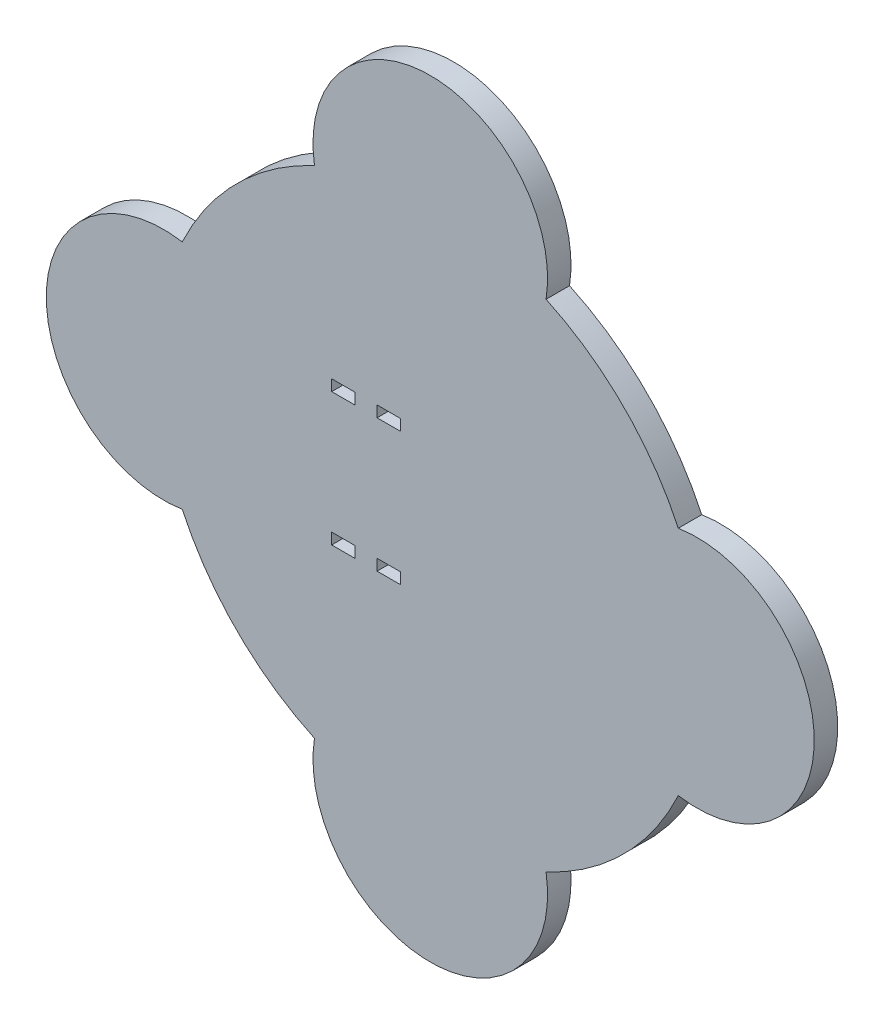
from build123d import *

# Parameters (mm, degrees)
SALIENTE_EXTRUIR1_DEPTH = 3
CORTAR_EXTRUIR1_REACH   = 71.508
CROQUIS4_W              = 3
CROQUIS4_H              = 1.42248357


with BuildPart() as part:
    # Croquis1 → Saliente-Extruir1 (new body)
    with BuildSketch(Plane.XY):
        with BuildLine():
            ThreePointArc((-31.713020554, -14.808252002), (-24.748737342, -24.748737342), (-14.808252002, -31.713020554))
            ThreePointArc((-14.808252002, -31.713020554), (0, -49.10376785), (14.808252002, -31.713020554))
            ThreePointArc((14.808252002, -31.713020554), (24.748737342, -24.748737342), (31.713020554, -14.808252002))
            ThreePointArc((31.713020554, -14.808252002), (49.10376785, 0), (31.713020554, 14.808252002))
            ThreePointArc((31.713020554, 14.808252002), (24.748737342, 24.748737342), (14.808252002, 31.713020554))
            ThreePointArc((14.808252002, 31.713020554), (0, 49.10376785), (-14.808252002, 31.713020554))
            ThreePointArc((-14.808252002, 31.713020554), (-24.748737342, 24.748737342), (-31.713020554, 14.808252002))
            ThreePointArc((-31.713020554, 14.808252002), (-49.10376785, 0), (-31.713020554, -14.808252002))
        make_face()
    extrude(amount=SALIENTE_EXTRUIR1_DEPTH)

    # Croquis4 → Cortar-Extruir1 (cut, up to next)
    with BuildSketch(Plane.XY.offset(3), mode=Mode.PRIVATE) as cortar_extruir1_sk1:
        with Locations((-5.30376785, -8.49072148)):
            Rectangle(CROQUIS4_W, CROQUIS4_H)
    cortar_extruir1_tool1 = extrude(cortar_extruir1_sk1.sketch, amount=-CORTAR_EXTRUIR1_REACH, mode=Mode.PRIVATE) & part.part
    # Croquis4 → Cortar-Extruir1 (cut, up to next)
    with BuildSketch(Plane.XY.offset(3), mode=Mode.PRIVATE) as cortar_extruir1_sk2:
        with Locations((-5.30376785, 8.49072148)):
            Rectangle(CROQUIS4_W, CROQUIS4_H)
    cortar_extruir1_tool2 = extrude(cortar_extruir1_sk2.sketch, amount=-CORTAR_EXTRUIR1_REACH, mode=Mode.PRIVATE) & part.part
    # Croquis4 → Cortar-Extruir1 (cut, up to next)
    with BuildSketch(Plane.XY.offset(3), mode=Mode.PRIVATE) as cortar_extruir1_sk3:
        with Locations((-11.10376785, 8.49072148)):
            Rectangle(CROQUIS4_W, CROQUIS4_H)
    cortar_extruir1_tool3 = extrude(cortar_extruir1_sk3.sketch, amount=-CORTAR_EXTRUIR1_REACH, mode=Mode.PRIVATE) & part.part
    # Croquis4 → Cortar-Extruir1 (cut, up to next)
    with BuildSketch(Plane.XY.offset(3), mode=Mode.PRIVATE) as cortar_extruir1_sk4:
        with Locations((-11.10376785, -8.49072148)):
            Rectangle(CROQUIS4_W, CROQUIS4_H)
    cortar_extruir1_tool4 = extrude(cortar_extruir1_sk4.sketch, amount=-CORTAR_EXTRUIR1_REACH, mode=Mode.PRIVATE) & part.part
    add(cortar_extruir1_tool1.solids().sort_by_distance((-5.303768, -8.490721, 3))[0], mode=Mode.SUBTRACT)
    add(cortar_extruir1_tool2.solids().sort_by_distance((-5.303768, 8.490721, 3))[0], mode=Mode.SUBTRACT)
    add(cortar_extruir1_tool3.solids().sort_by_distance((-11.103768, 8.490721, 3))[0], mode=Mode.SUBTRACT)
    add(cortar_extruir1_tool4.solids().sort_by_distance((-11.103768, -8.490721, 3))[0], mode=Mode.SUBTRACT)


solid = part.part
